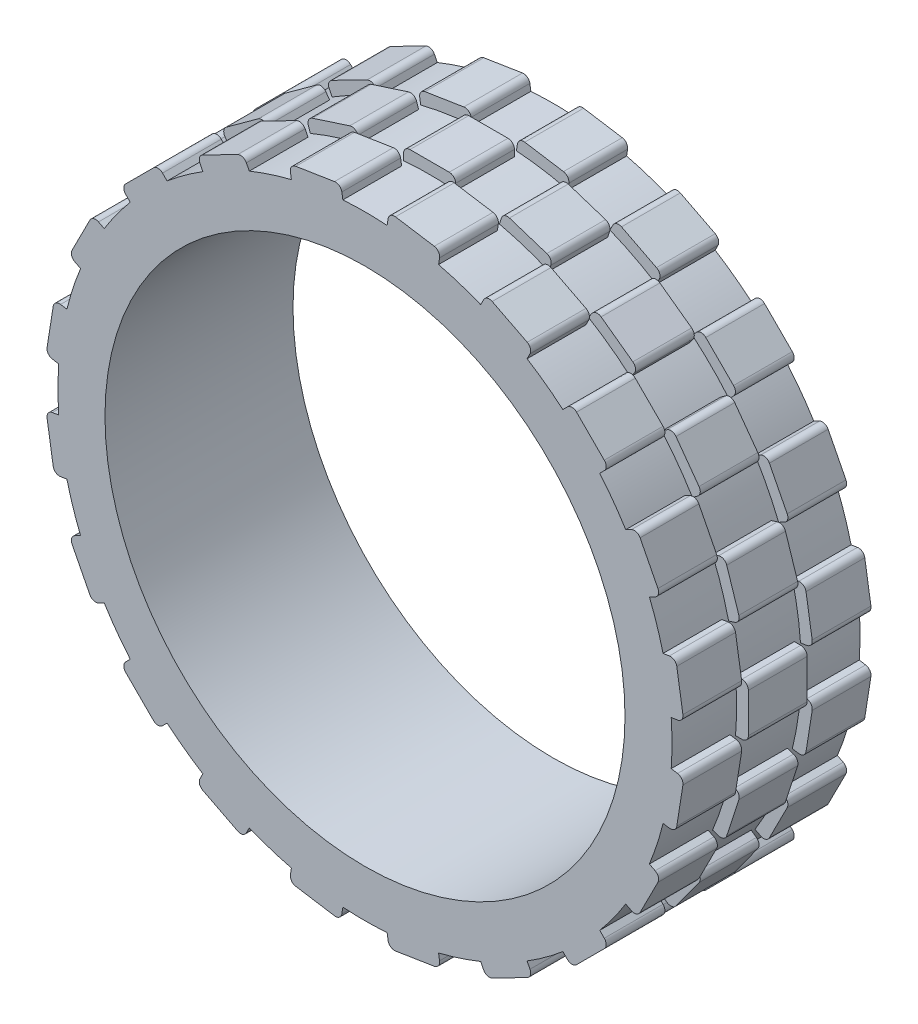
from build123d import *

# Parameters (mm, degrees)
SKETCH1_R             = 26.125
SKETCH1_R_2           = 22.125
BOSS_EXTRUDE1_DEPTH   = 16
BOSS_EXTRUDE2_DEPTH   = 2.5
CIRPATTERN1_COUNT     = 20
BOSS_EXTRUDE3_START   = -3
BOSS_EXTRUDE3_DEPTH   = 5
CIRPATTERN2_COUNT     = 20
MIRROR1_START         = -3
MIRROR1_COPY_1_DEPTH  = 5
MIRROR1_COPY_2_DEPTH  = 5
MIRROR1_COPY_3_DEPTH  = 5
MIRROR1_COPY_4_DEPTH  = 5
MIRROR1_COPY_5_DEPTH  = 5
MIRROR1_COPY_6_DEPTH  = 5
MIRROR1_COPY_7_DEPTH  = 5
MIRROR1_COPY_8_DEPTH  = 5
MIRROR1_COPY_9_DEPTH  = 5
MIRROR1_COPY_10_DEPTH = 5
MIRROR1_COPY_11_DEPTH = 5
MIRROR1_COPY_12_DEPTH = 5
MIRROR1_COPY_13_DEPTH = 5
MIRROR1_COPY_14_DEPTH = 5
MIRROR1_COPY_15_DEPTH = 5
MIRROR1_COPY_16_DEPTH = 5
MIRROR1_COPY_17_DEPTH = 5
MIRROR1_COPY_18_DEPTH = 5
MIRROR1_COPY_19_DEPTH = 5
MIRROR1_COPY_20_DEPTH = 5


with BuildPart() as part:
    # Sketch1 → Boss-Extrude1 (new body)
    with BuildSketch(Plane.XY):
        Circle(SKETCH1_R)
        Circle(SKETCH1_R_2, mode=Mode.SUBTRACT)
    extrude(amount=BOSS_EXTRUDE1_DEPTH)

    # Sketch4 → Boss-Extrude2 (add, symmetric)
    with BuildSketch(Plane(origin=(0, 0, 8), x_dir=(-1, 0, 0), z_dir=(0, 0, -1))):
        with BuildLine():
            Line((-1.669252983, 27.125), (1.669252983, 27.125))
            ThreePointArc((1.669252983, 27.125), (2.055865162, 26.964859992), (2.21600517, 26.578247813))
            Line((2.21600517, 26.578247813), (2.21600517, 24.07207844))
            Line((2.21600517, 24.07207844), (-2.21600517, 24.07207844))
            Line((-2.21600517, 24.07207844), (-2.21600517, 26.578247813))
            ThreePointArc((-2.21600517, 26.578247813), (-2.055865162, 26.964859992), (-1.669252983, 27.125))
        make_face()
    boss_extrude2 = extrude(amount=BOSS_EXTRUDE2_DEPTH, both=True)

    # CirPattern1: Boss-Extrude2 ×20 about axis
    cirpattern1_axis = Axis((0, 0, 17.090234349), (0, 0, -1))
    for i in range(1, CIRPATTERN1_COUNT):
        add(boss_extrude2.rotate(cirpattern1_axis, i * 360 / CIRPATTERN1_COUNT))

    # Sketch6 → Boss-Extrude3 (add)
    with BuildSketch(Plane.XY.offset(3).offset(BOSS_EXTRUDE3_START)):
        with BuildLine():
            Line((2.594583155, 27.052174936), (5.891986573, 26.529917541))
            ThreePointArc((5.891986573, 26.529917541), (6.248787498, 26.311269653), (6.346476448, 25.904365895))
            Line((6.346476448, 25.904365895), (5.962703938, 23.481321634))
            Line((5.962703938, 23.481321634), (1.585259, 24.1746408))
            Line((1.585259, 24.1746408), (1.969031509, 26.597685062))
            ThreePointArc((1.969031509, 26.597685062), (2.187679397, 26.954485987), (2.594583155, 27.052174936))
        make_face()
    boss_extrude3 = extrude(amount=BOSS_EXTRUDE3_DEPTH)

    # CirPattern2: Boss-Extrude3 ×20 about axis
    cirpattern2_axis = Axis((0, 0, 17.090234349), (0, 0, -1))
    for i in range(1, CIRPATTERN2_COUNT):
        add(boss_extrude3.rotate(cirpattern2_axis, i * 360 / CIRPATTERN2_COUNT))

    # Mirror1 copy 1 sketch → Mirror1 copy 1 (add)
    with BuildSketch(Plane(origin=(0, 0, 13), x_dir=(0.9510565162951535, -0.3090169943749474, 0), z_dir=(0, 0, -1)).offset(MIRROR1_START)):
        with BuildLine():
            Line((2.594583155, -27.052174936), (5.891986573, -26.529917541))
            ThreePointArc((5.891986573, -26.529917541), (6.248787498, -26.311269653), (6.346476448, -25.904365895))
            Line((6.346476448, -25.904365895), (5.962703938, -23.481321634))
            Line((5.962703938, -23.481321634), (1.585259, -24.1746408))
            Line((1.585259, -24.1746408), (1.969031509, -26.597685062))
            ThreePointArc((1.969031509, -26.597685062), (2.187679397, -26.954485987), (2.594583155, -27.052174936))
        make_face()
    extrude(amount=MIRROR1_COPY_1_DEPTH)

    # Mirror1 copy 2 sketch → Mirror1 copy 2 (add)
    with BuildSketch(Plane(origin=(0, 0, 13), x_dir=(0.8090169943749475, -0.5877852522924731, 0), z_dir=(0, 0, -1)).offset(MIRROR1_START)):
        with BuildLine():
            Line((2.594583155, -27.052174936), (5.891986573, -26.529917541))
            ThreePointArc((5.891986573, -26.529917541), (6.248787498, -26.311269653), (6.346476448, -25.904365895))
            Line((6.346476448, -25.904365895), (5.962703938, -23.481321634))
            Line((5.962703938, -23.481321634), (1.585259, -24.1746408))
            Line((1.585259, -24.1746408), (1.969031509, -26.597685062))
            ThreePointArc((1.969031509, -26.597685062), (2.187679397, -26.954485987), (2.594583155, -27.052174936))
        make_face()
    extrude(amount=MIRROR1_COPY_2_DEPTH)

    # Mirror1 copy 3 sketch → Mirror1 copy 3 (add)
    with BuildSketch(Plane(origin=(0, 0, 13), x_dir=(0.5877852522924731, -0.8090169943749475, 0), z_dir=(0, 0, -1)).offset(MIRROR1_START)):
        with BuildLine():
            Line((2.594583155, -27.052174936), (5.891986573, -26.529917541))
            ThreePointArc((5.891986573, -26.529917541), (6.248787498, -26.311269653), (6.346476448, -25.904365895))
            Line((6.346476448, -25.904365895), (5.962703938, -23.481321634))
            Line((5.962703938, -23.481321634), (1.585259, -24.1746408))
            Line((1.585259, -24.1746408), (1.969031509, -26.597685062))
            ThreePointArc((1.969031509, -26.597685062), (2.187679397, -26.954485987), (2.594583155, -27.052174936))
        make_face()
    extrude(amount=MIRROR1_COPY_3_DEPTH)

    # Mirror1 copy 4 sketch → Mirror1 copy 4 (add)
    with BuildSketch(Plane(origin=(0, 0, 13), x_dir=(0.30901699437494745, -0.9510565162951535, 0), z_dir=(0, 0, -1)).offset(MIRROR1_START)):
        with BuildLine():
            Line((2.594583155, -27.052174936), (5.891986573, -26.529917541))
            ThreePointArc((5.891986573, -26.529917541), (6.248787498, -26.311269653), (6.346476448, -25.904365895))
            Line((6.346476448, -25.904365895), (5.962703938, -23.481321634))
            Line((5.962703938, -23.481321634), (1.585259, -24.1746408))
            Line((1.585259, -24.1746408), (1.969031509, -26.597685062))
            ThreePointArc((1.969031509, -26.597685062), (2.187679397, -26.954485987), (2.594583155, -27.052174936))
        make_face()
    extrude(amount=MIRROR1_COPY_4_DEPTH)

    # Mirror1 copy 5 sketch → Mirror1 copy 5 (add)
    with BuildSketch(Plane(origin=(0, 0, 13), x_dir=(0, -1, 0), z_dir=(0, 0, -1)).offset(MIRROR1_START)):
        with BuildLine():
            Line((2.594583155, -27.052174936), (5.891986573, -26.529917541))
            ThreePointArc((5.891986573, -26.529917541), (6.248787498, -26.311269653), (6.346476448, -25.904365895))
            Line((6.346476448, -25.904365895), (5.962703938, -23.481321634))
            Line((5.962703938, -23.481321634), (1.585259, -24.1746408))
            Line((1.585259, -24.1746408), (1.969031509, -26.597685062))
            ThreePointArc((1.969031509, -26.597685062), (2.187679397, -26.954485987), (2.594583155, -27.052174936))
        make_face()
    extrude(amount=MIRROR1_COPY_5_DEPTH)

    # Mirror1 copy 6 sketch → Mirror1 copy 6 (add)
    with BuildSketch(Plane(origin=(0, 0, 13), x_dir=(-0.30901699437494734, -0.9510565162951536, 0), z_dir=(0, 0, -1)).offset(MIRROR1_START)):
        with BuildLine():
            Line((2.594583155, -27.052174936), (5.891986573, -26.529917541))
            ThreePointArc((5.891986573, -26.529917541), (6.248787498, -26.311269653), (6.346476448, -25.904365895))
            Line((6.346476448, -25.904365895), (5.962703938, -23.481321634))
            Line((5.962703938, -23.481321634), (1.585259, -24.1746408))
            Line((1.585259, -24.1746408), (1.969031509, -26.597685062))
            ThreePointArc((1.969031509, -26.597685062), (2.187679397, -26.954485987), (2.594583155, -27.052174936))
        make_face()
    extrude(amount=MIRROR1_COPY_6_DEPTH)

    # Mirror1 copy 7 sketch → Mirror1 copy 7 (add)
    with BuildSketch(Plane(origin=(0, 0, 13), x_dir=(-0.587785252292473, -0.8090169943749475, 0), z_dir=(0, 0, -1)).offset(MIRROR1_START)):
        with BuildLine():
            Line((2.594583155, -27.052174936), (5.891986573, -26.529917541))
            ThreePointArc((5.891986573, -26.529917541), (6.248787498, -26.311269653), (6.346476448, -25.904365895))
            Line((6.346476448, -25.904365895), (5.962703938, -23.481321634))
            Line((5.962703938, -23.481321634), (1.585259, -24.1746408))
            Line((1.585259, -24.1746408), (1.969031509, -26.597685062))
            ThreePointArc((1.969031509, -26.597685062), (2.187679397, -26.954485987), (2.594583155, -27.052174936))
        make_face()
    extrude(amount=MIRROR1_COPY_7_DEPTH)

    # Mirror1 copy 8 sketch → Mirror1 copy 8 (add)
    with BuildSketch(Plane(origin=(0, 0, 13), x_dir=(-0.8090169943749473, -0.5877852522924732, 0), z_dir=(0, 0, -1)).offset(MIRROR1_START)):
        with BuildLine():
            Line((2.594583155, -27.052174936), (5.891986573, -26.529917541))
            ThreePointArc((5.891986573, -26.529917541), (6.248787498, -26.311269653), (6.346476448, -25.904365895))
            Line((6.346476448, -25.904365895), (5.962703938, -23.481321634))
            Line((5.962703938, -23.481321634), (1.585259, -24.1746408))
            Line((1.585259, -24.1746408), (1.969031509, -26.597685062))
            ThreePointArc((1.969031509, -26.597685062), (2.187679397, -26.954485987), (2.594583155, -27.052174936))
        make_face()
    extrude(amount=MIRROR1_COPY_8_DEPTH)

    # Mirror1 copy 9 sketch → Mirror1 copy 9 (add)
    with BuildSketch(Plane(origin=(0, 0, 13), x_dir=(-0.9510565162951535, -0.3090169943749475, 0), z_dir=(0, 0, -1)).offset(MIRROR1_START)):
        with BuildLine():
            Line((2.594583155, -27.052174936), (5.891986573, -26.529917541))
            ThreePointArc((5.891986573, -26.529917541), (6.248787498, -26.311269653), (6.346476448, -25.904365895))
            Line((6.346476448, -25.904365895), (5.962703938, -23.481321634))
            Line((5.962703938, -23.481321634), (1.585259, -24.1746408))
            Line((1.585259, -24.1746408), (1.969031509, -26.597685062))
            ThreePointArc((1.969031509, -26.597685062), (2.187679397, -26.954485987), (2.594583155, -27.052174936))
        make_face()
    extrude(amount=MIRROR1_COPY_9_DEPTH)

    # Mirror1 copy 10 sketch → Mirror1 copy 10 (add)
    with BuildSketch(Plane(origin=(0, 0, 13), x_dir=(-1, 0, 0), z_dir=(0, 0, -1)).offset(MIRROR1_START)):
        with BuildLine():
            Line((2.594583155, -27.052174936), (5.891986573, -26.529917541))
            ThreePointArc((5.891986573, -26.529917541), (6.248787498, -26.311269653), (6.346476448, -25.904365895))
            Line((6.346476448, -25.904365895), (5.962703938, -23.481321634))
            Line((5.962703938, -23.481321634), (1.585259, -24.1746408))
            Line((1.585259, -24.1746408), (1.969031509, -26.597685062))
            ThreePointArc((1.969031509, -26.597685062), (2.187679397, -26.954485987), (2.594583155, -27.052174936))
        make_face()
    extrude(amount=MIRROR1_COPY_10_DEPTH)

    # Mirror1 copy 11 sketch → Mirror1 copy 11 (add)
    with BuildSketch(Plane(origin=(0, 0, 13), x_dir=(-0.9510565162951536, 0.3090169943749473, 0), z_dir=(0, 0, -1)).offset(MIRROR1_START)):
        with BuildLine():
            Line((2.594583155, -27.052174936), (5.891986573, -26.529917541))
            ThreePointArc((5.891986573, -26.529917541), (6.248787498, -26.311269653), (6.346476448, -25.904365895))
            Line((6.346476448, -25.904365895), (5.962703938, -23.481321634))
            Line((5.962703938, -23.481321634), (1.585259, -24.1746408))
            Line((1.585259, -24.1746408), (1.969031509, -26.597685062))
            ThreePointArc((1.969031509, -26.597685062), (2.187679397, -26.954485987), (2.594583155, -27.052174936))
        make_face()
    extrude(amount=MIRROR1_COPY_11_DEPTH)

    # Mirror1 copy 12 sketch → Mirror1 copy 12 (add)
    with BuildSketch(Plane(origin=(0, 0, 13), x_dir=(-0.8090169943749476, 0.587785252292473, 0), z_dir=(0, 0, -1)).offset(MIRROR1_START)):
        with BuildLine():
            Line((2.594583155, -27.052174936), (5.891986573, -26.529917541))
            ThreePointArc((5.891986573, -26.529917541), (6.248787498, -26.311269653), (6.346476448, -25.904365895))
            Line((6.346476448, -25.904365895), (5.962703938, -23.481321634))
            Line((5.962703938, -23.481321634), (1.585259, -24.1746408))
            Line((1.585259, -24.1746408), (1.969031509, -26.597685062))
            ThreePointArc((1.969031509, -26.597685062), (2.187679397, -26.954485987), (2.594583155, -27.052174936))
        make_face()
    extrude(amount=MIRROR1_COPY_12_DEPTH)

    # Mirror1 copy 13 sketch → Mirror1 copy 13 (add)
    with BuildSketch(Plane(origin=(0, 0, 13), x_dir=(-0.5877852522924732, 0.8090169943749473, 0), z_dir=(0, 0, -1)).offset(MIRROR1_START)):
        with BuildLine():
            Line((2.594583155, -27.052174936), (5.891986573, -26.529917541))
            ThreePointArc((5.891986573, -26.529917541), (6.248787498, -26.311269653), (6.346476448, -25.904365895))
            Line((6.346476448, -25.904365895), (5.962703938, -23.481321634))
            Line((5.962703938, -23.481321634), (1.585259, -24.1746408))
            Line((1.585259, -24.1746408), (1.969031509, -26.597685062))
            ThreePointArc((1.969031509, -26.597685062), (2.187679397, -26.954485987), (2.594583155, -27.052174936))
        make_face()
    extrude(amount=MIRROR1_COPY_13_DEPTH)

    # Mirror1 copy 14 sketch → Mirror1 copy 14 (add)
    with BuildSketch(Plane(origin=(0, 0, 13), x_dir=(-0.30901699437494756, 0.9510565162951535, 0), z_dir=(0, 0, -1)).offset(MIRROR1_START)):
        with BuildLine():
            Line((2.594583155, -27.052174936), (5.891986573, -26.529917541))
            ThreePointArc((5.891986573, -26.529917541), (6.248787498, -26.311269653), (6.346476448, -25.904365895))
            Line((6.346476448, -25.904365895), (5.962703938, -23.481321634))
            Line((5.962703938, -23.481321634), (1.585259, -24.1746408))
            Line((1.585259, -24.1746408), (1.969031509, -26.597685062))
            ThreePointArc((1.969031509, -26.597685062), (2.187679397, -26.954485987), (2.594583155, -27.052174936))
        make_face()
    extrude(amount=MIRROR1_COPY_14_DEPTH)

    # Mirror1 copy 15 sketch → Mirror1 copy 15 (add)
    with BuildSketch(Plane.YX.offset(-13).offset(MIRROR1_START)):
        with BuildLine():
            Line((2.594583155, -27.052174936), (5.891986573, -26.529917541))
            ThreePointArc((5.891986573, -26.529917541), (6.248787498, -26.311269653), (6.346476448, -25.904365895))
            Line((6.346476448, -25.904365895), (5.962703938, -23.481321634))
            Line((5.962703938, -23.481321634), (1.585259, -24.1746408))
            Line((1.585259, -24.1746408), (1.969031509, -26.597685062))
            ThreePointArc((1.969031509, -26.597685062), (2.187679397, -26.954485987), (2.594583155, -27.052174936))
        make_face()
    extrude(amount=MIRROR1_COPY_15_DEPTH)

    # Mirror1 copy 16 sketch → Mirror1 copy 16 (add)
    with BuildSketch(Plane(origin=(0, 0, 13), x_dir=(0.30901699437494723, 0.9510565162951536, 0), z_dir=(0, 0, -1)).offset(MIRROR1_START)):
        with BuildLine():
            Line((2.594583155, -27.052174936), (5.891986573, -26.529917541))
            ThreePointArc((5.891986573, -26.529917541), (6.248787498, -26.311269653), (6.346476448, -25.904365895))
            Line((6.346476448, -25.904365895), (5.962703938, -23.481321634))
            Line((5.962703938, -23.481321634), (1.585259, -24.1746408))
            Line((1.585259, -24.1746408), (1.969031509, -26.597685062))
            ThreePointArc((1.969031509, -26.597685062), (2.187679397, -26.954485987), (2.594583155, -27.052174936))
        make_face()
    extrude(amount=MIRROR1_COPY_16_DEPTH)

    # Mirror1 copy 17 sketch → Mirror1 copy 17 (add)
    with BuildSketch(Plane(origin=(0, 0, 13), x_dir=(0.5877852522924729, 0.8090169943749476, 0), z_dir=(0, 0, -1)).offset(MIRROR1_START)):
        with BuildLine():
            Line((2.594583155, -27.052174936), (5.891986573, -26.529917541))
            ThreePointArc((5.891986573, -26.529917541), (6.248787498, -26.311269653), (6.346476448, -25.904365895))
            Line((6.346476448, -25.904365895), (5.962703938, -23.481321634))
            Line((5.962703938, -23.481321634), (1.585259, -24.1746408))
            Line((1.585259, -24.1746408), (1.969031509, -26.597685062))
            ThreePointArc((1.969031509, -26.597685062), (2.187679397, -26.954485987), (2.594583155, -27.052174936))
        make_face()
    extrude(amount=MIRROR1_COPY_17_DEPTH)

    # Mirror1 copy 18 sketch → Mirror1 copy 18 (add)
    with BuildSketch(Plane(origin=(0, 0, 13), x_dir=(0.8090169943749473, 0.5877852522924734, 0), z_dir=(0, 0, -1)).offset(MIRROR1_START)):
        with BuildLine():
            Line((2.594583155, -27.052174936), (5.891986573, -26.529917541))
            ThreePointArc((5.891986573, -26.529917541), (6.248787498, -26.311269653), (6.346476448, -25.904365895))
            Line((6.346476448, -25.904365895), (5.962703938, -23.481321634))
            Line((5.962703938, -23.481321634), (1.585259, -24.1746408))
            Line((1.585259, -24.1746408), (1.969031509, -26.597685062))
            ThreePointArc((1.969031509, -26.597685062), (2.187679397, -26.954485987), (2.594583155, -27.052174936))
        make_face()
    extrude(amount=MIRROR1_COPY_18_DEPTH)

    # Mirror1 copy 19 sketch → Mirror1 copy 19 (add)
    with BuildSketch(Plane(origin=(0, 0, 13), x_dir=(0.9510565162951535, 0.3090169943749476, 0), z_dir=(0, 0, -1)).offset(MIRROR1_START)):
        with BuildLine():
            Line((2.594583155, -27.052174936), (5.891986573, -26.529917541))
            ThreePointArc((5.891986573, -26.529917541), (6.248787498, -26.311269653), (6.346476448, -25.904365895))
            Line((6.346476448, -25.904365895), (5.962703938, -23.481321634))
            Line((5.962703938, -23.481321634), (1.585259, -24.1746408))
            Line((1.585259, -24.1746408), (1.969031509, -26.597685062))
            ThreePointArc((1.969031509, -26.597685062), (2.187679397, -26.954485987), (2.594583155, -27.052174936))
        make_face()
    extrude(amount=MIRROR1_COPY_19_DEPTH)

    # Mirror1 copy 20 sketch → Mirror1 copy 20 (add)
    with BuildSketch(Plane(origin=(0, 0, 13), x_dir=(1, 0, 0), z_dir=(0, 0, -1)).offset(MIRROR1_START)):
        with BuildLine():
            Line((2.594583155, -27.052174936), (5.891986573, -26.529917541))
            ThreePointArc((5.891986573, -26.529917541), (6.248787498, -26.311269653), (6.346476448, -25.904365895))
            Line((6.346476448, -25.904365895), (5.962703938, -23.481321634))
            Line((5.962703938, -23.481321634), (1.585259, -24.1746408))
            Line((1.585259, -24.1746408), (1.969031509, -26.597685062))
            ThreePointArc((1.969031509, -26.597685062), (2.187679397, -26.954485987), (2.594583155, -27.052174936))
        make_face()
    extrude(amount=MIRROR1_COPY_20_DEPTH)


solid = part.part
